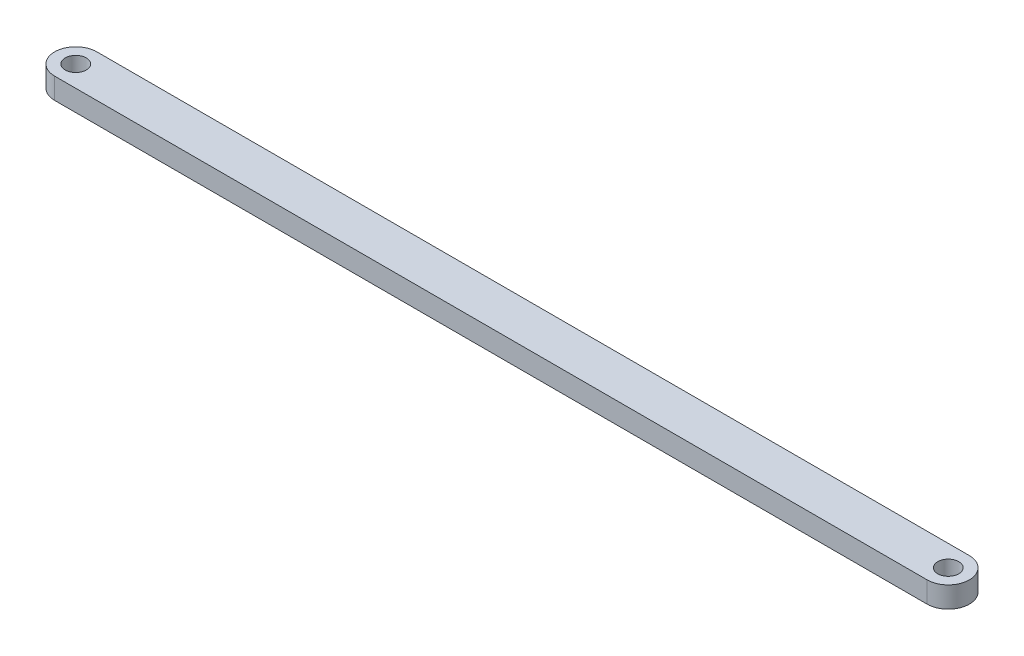
from build123d import *

# Parameters (mm, degrees)
SKETCH_2_R      = 5
SKETCH_2_R_2    = 2.5
EXTRUDE_1_DEPTH = 5


with BuildPart() as part:
    # 草图2 → 凸台-拉伸1 (new body)
    # profile 1 of 3: a face of its own
    with BuildSketch(Plane(origin=(0, 0, 0), x_dir=(1, 0, 0), z_dir=(0, 1, 0))):
        with BuildLine():
            ThreePointArc((5, 0), (3.535533906, -3.535533906), (0, -5))
            Line((0, -5), (207.06, -5))
            ThreePointArc((207.06, -5), (202.06, 0), (207.06, 5))
            Line((207.06, 5), (0, 5))
            ThreePointArc((0, 5), (3.535533906, 3.535533906), (5, 0))
        make_face()
    # profile 2 of 3: a face of its own
    with BuildSketch(Plane(origin=(0, 0, 0), x_dir=(1, 0, 0), z_dir=(0, 1, 0))):
        Circle(SKETCH_2_R)
        with Locations(Location((0, 0, 0), (0, 0, 270))):
            Circle(SKETCH_2_R_2, mode=Mode.SUBTRACT)
    # profile 3 of 3: a face of its own
    with BuildSketch(Plane(origin=(0, 0, 0), x_dir=(1, 0, 0), z_dir=(0, 1, 0))):
        with Locations((207.06, 0)):
            Circle(SKETCH_2_R)
        with Locations(Location((207.06, 0, 0), (0, 0, 270))):
            Circle(SKETCH_2_R_2, mode=Mode.SUBTRACT)
    extrude(amount=EXTRUDE_1_DEPTH)


solid = part.part
